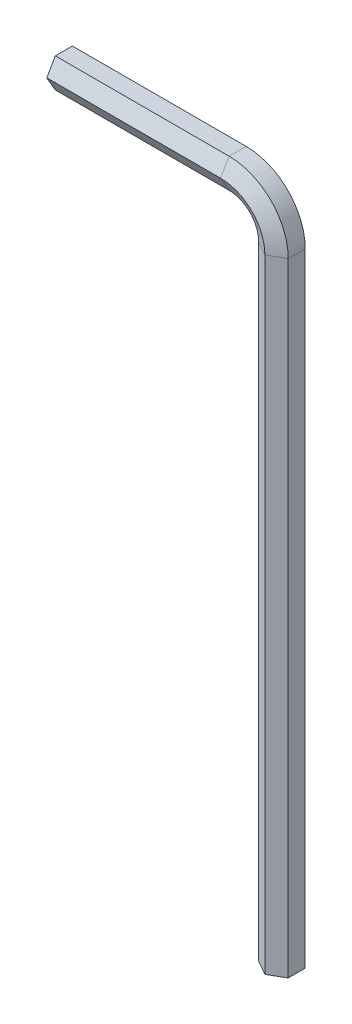
from build123d import *


with BuildPart() as part:
    # Sweep1: sweep along a path in Sketch2
    with BuildLine(Plane.XY) as sweep1_path:
        Line((0, 0), (0, 52.7))
        ThreePointArc((0, 52.7), (-1.098349571, 55.351650429), (-3.75, 56.45))
        Line((-3.75, 56.45), (-18.45, 56.45))
    # Sketch1 → Sweep1 (sweep)
    with BuildSketch(Plane(origin=(0, 0, 0), x_dir=(1, 0, 0), z_dir=(0, 1, 0))):
        Polygon((0, 1.443375673), (-1.25, 0.721687836), (-1.25, -0.721687836), (0, -1.443375673), (1.25, -0.721687836), (1.25, 0.721687836), align=None)
    sweep(path=sweep1_path.line)


solid = part.part
